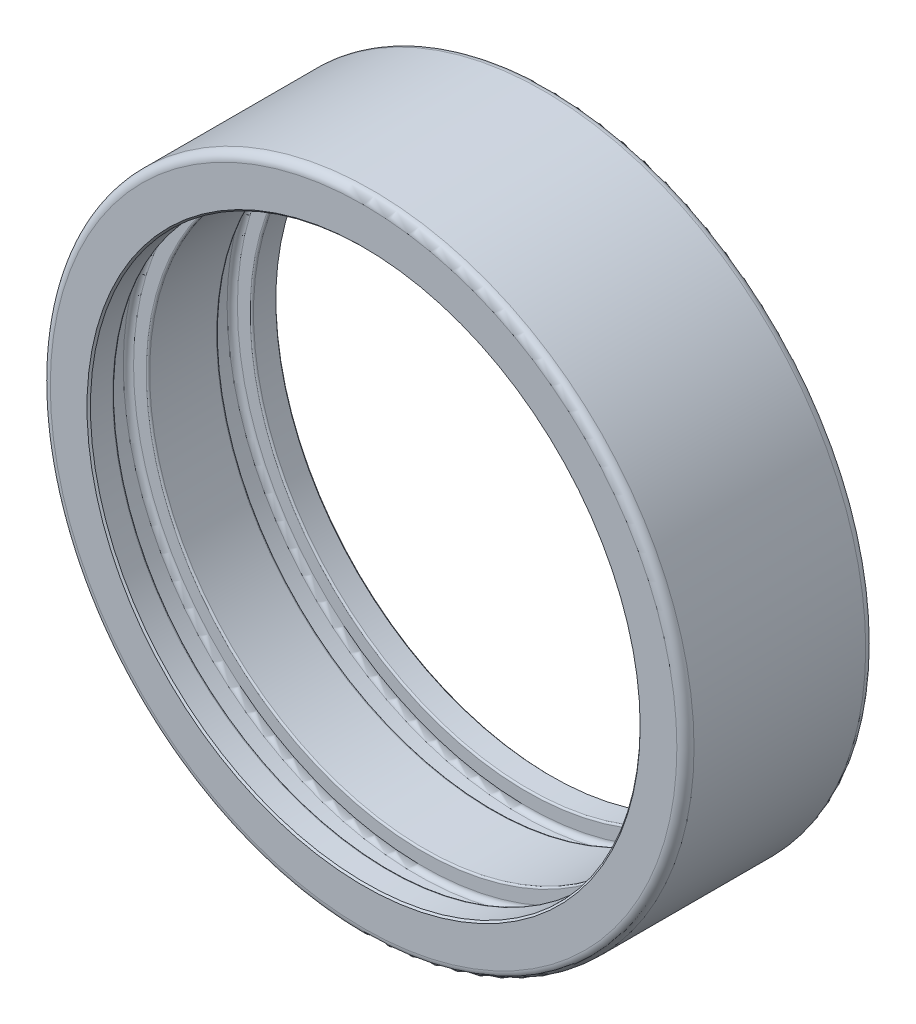
from build123d import *

# Parameters (mm, degrees)
SKIZZE1_R               = 37.5
SKIZZE1_R_2             = 32.025
LINEAR_AUSTRAGEN1_DEPTH = 22
VERRUNDUNG1_R           = 1
VERRUNDUNG2_R           = 0.2
FASE1_SIZE              = 0.2


with BuildPart() as part:
    # Skizze1 → Linear austragen1 (new body)
    with BuildSketch(Plane.XY):
        Circle(SKIZZE1_R)
        Circle(SKIZZE1_R_2, mode=Mode.SUBTRACT)
    extrude(amount=LINEAR_AUSTRAGEN1_DEPTH)

    # Verrundung1
    verrundung1_edges = [part.edges().sort_by_distance(p)[0] for p in [
        (-37.5, 0, 0),
        (-37.5, 0, 22),
    ]]
    fillet(verrundung1_edges, radius=VERRUNDUNG1_R)

    # Skizze2 → Schnitt-Rotation1 (revolve, cut)
    with BuildSketch(Plane(origin=(0, 0, 0), x_dir=(0, 0, -1), z_dir=(1, 0, 0)), mode=Mode.PRIVATE) as schnitt_rotation1_sk:
        with BuildLine():
            Line((-6.3, 34.3), (-3.6, 34.3))
            ThreePointArc((-3.6, 34.3), (-3.175735931, 34.124264069), (-3, 33.7))
            Line((-3, 33.7), (-3, 0))
            Line((-3, 0), (-6.9, 0))
            Line((-6.9, 0), (-6.9, 33.7))
            ThreePointArc((-6.9, 33.7), (-6.724264069, 34.124264069), (-6.3, 34.3))
        make_face()
        with BuildLine():
            Line((-18.4, 34.3), (-15.7, 34.3))
            ThreePointArc((-15.7, 34.3), (-15.275735931, 34.124264069), (-15.1, 33.7))
            Line((-15.1, 33.7), (-15.1, 0))
            Line((-15.1, 0), (-19, 0))
            Line((-19, 0), (-19, 33.7))
            ThreePointArc((-19, 33.7), (-18.824264069, 34.124264069), (-18.4, 34.3))
        make_face()
    revolve(schnitt_rotation1_sk.sketch.rotate(Axis((0, 0, 0), (0, 0, 1)), 90), axis=Axis((0, 0, 0), (0, 0, 1)), mode=Mode.SUBTRACT)

    # Verrundung2
    verrundung2_edges = [part.edges().sort_by_distance(p)[0] for p in [
        (-32.025, 0, 19),
        (-32.025, 0, 15.1),
        (-32.025, 0, 6.9),
        (-32.025, 0, 3),
    ]]
    fillet(verrundung2_edges, radius=VERRUNDUNG2_R)

    # Fase1
    fase1_edges = [part.edges().sort_by_distance(p)[0] for p in [
        (-32.025, 0, 0),
        (-32.025, 0, 22),
    ]]
    chamfer(fase1_edges, length=FASE1_SIZE)


solid = part.part
